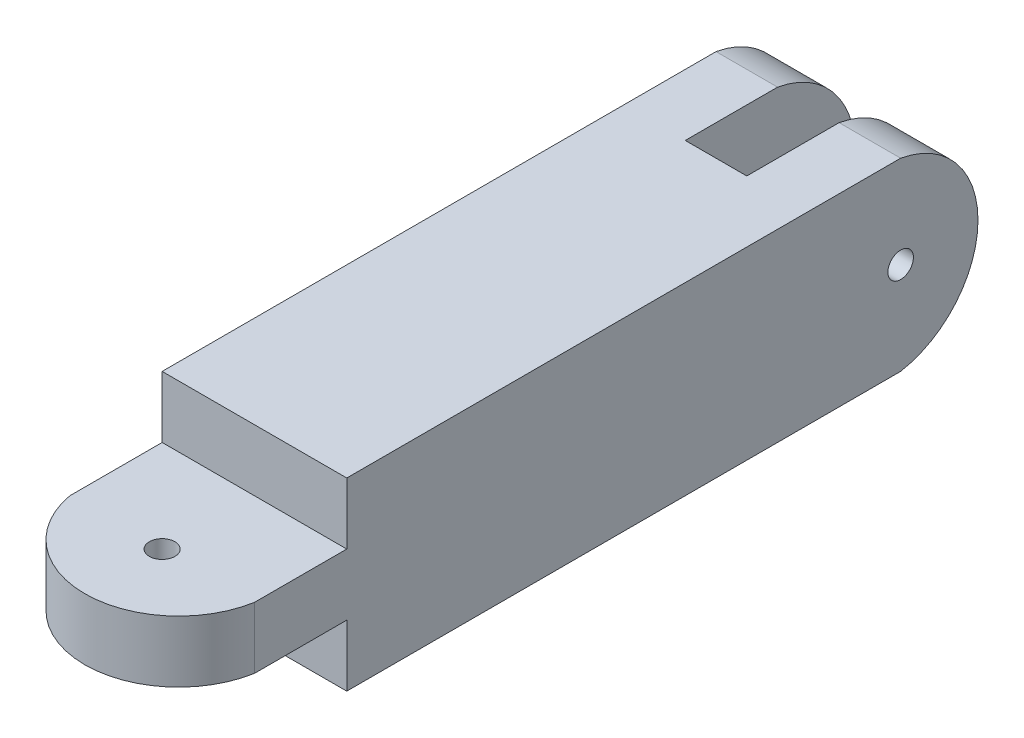
from build123d import *

# Parameters (mm, degrees)
SKETCH2_W               = 60
SKETCH2_H               = 60
BOSS_EXTRUDE1_DEPTH     = 150
SKETCH3_W               = 20
SKETCH3_H               = 60
BOSS_EXTRUDE2_DEPTH     = 30
BOSS_EXTRUDE3_DEPTH     = 20
BOSS_EXTRUDE4_START     = -20
BOSS_EXTRUDE4_DEPTH     = 20
SKETCH6_W               = 60
SKETCH6_H               = 20
BOSS_EXTRUDE5_DEPTH     = 30
BOSS_EXTRUDE6_DEPTH     = 20
CUT_EXTRUDE2_DEPTH      = 5
CUT_EXTRUDE2_DEPTH_BACK = 130
CUT_EXTRUDE2_START      = -10
SKETCH8_W               = 50.5
SKETCH8_H               = 50.5
SKETCH9_R               = 4.15
CUT_EXTRUDE3_DEPTH      = 130
SKETCH11_R              = 4.15
CUT_EXTRUDE4_DEPTH      = 212.144400343
SKETCH12_R              = 4.15
CUT_EXTRUDE5_DEPTH      = 212.144400343


with BuildPart() as part:
    # Sketch2 → Boss-Extrude1 (new body)
    with BuildSketch(Plane.XY):
        Rectangle(SKETCH2_W, SKETCH2_H)
    extrude(amount=BOSS_EXTRUDE1_DEPTH)

    # Sketch3 → Boss-Extrude2 (add)
    with BuildSketch(Plane(origin=(0, 0, 0), x_dir=(-1, 0, 0), z_dir=(0, 0, -1))):
        with Locations((20, 0)):
            Rectangle(SKETCH3_W, SKETCH3_H)
        with Locations((-20, 0)):
            Rectangle(SKETCH3_W, SKETCH3_H)
    extrude(amount=BOSS_EXTRUDE2_DEPTH)

    # Sketch4 → Boss-Extrude3 (add)
    with BuildSketch(Plane(origin=(30, 0, 0), x_dir=(0, 0, -1), z_dir=(1, 0, 0))):
        with BuildLine():
            Line((30, 30), (30, -30))
            ThreePointArc((30, -30), (55.138874415, 0), (30, 30))
        make_face()
    extrude(amount=-BOSS_EXTRUDE3_DEPTH)

    # Sketch5 → Boss-Extrude4 (add)
    with BuildSketch(Plane.ZY.offset(30).offset(BOSS_EXTRUDE4_START)):
        with BuildLine():
            Line((-30, -30), (-30, 30))
            ThreePointArc((-30, 30), (-55.138874415, 0), (-30, -30))
        make_face()
    extrude(amount=BOSS_EXTRUDE4_DEPTH)

    # Sketch6 → Boss-Extrude5 (add)
    with BuildSketch(Plane.XY.offset(150)):
        Rectangle(SKETCH6_W, SKETCH6_H)
    extrude(amount=BOSS_EXTRUDE5_DEPTH)

    # Sketch7 → Boss-Extrude6 (add)
    with BuildSketch(Plane(origin=(0, 10, 0), x_dir=(1, 0, 0), z_dir=(0, 1, 0))):
        with BuildLine():
            Line((30, -180), (-30, -180))
            ThreePointArc((-30, -180), (0, -205.138874415), (30, -180))
        make_face()
    extrude(amount=-BOSS_EXTRUDE6_DEPTH)

    # Sketch8 → Cut-Extrude2 (cut, two sides: drawn at the far end of the back side and taken through both)
    with BuildSketch(Plane.XY.offset(150).offset(CUT_EXTRUDE2_START - CUT_EXTRUDE2_DEPTH_BACK)):
        Rectangle(SKETCH8_W, SKETCH8_H)
    extrude(amount=CUT_EXTRUDE2_DEPTH + CUT_EXTRUDE2_DEPTH_BACK, mode=Mode.SUBTRACT)

    # Sketch9 → Cut-Extrude3 (cut)
    with BuildSketch(Plane(origin=(0, -10, 0), x_dir=(-1, 0, 0), z_dir=(0, -1, 0))):
        with Locations(Location((0, -180, 0), (0, 0, 90))):
            Circle(SKETCH9_R)
    extrude(amount=-CUT_EXTRUDE3_DEPTH, mode=Mode.SUBTRACT)

    # Sketch11 → Cut-Extrude4 (cut, through all)
    with BuildSketch(Plane.ZY.offset(-10)):
        with Locations(Location((-30, 0, 0), (0, 0, 270))):
            Circle(SKETCH11_R)
    extrude(amount=-CUT_EXTRUDE4_DEPTH, mode=Mode.SUBTRACT)

    # Sketch12 → Cut-Extrude5 (cut, through all)
    with BuildSketch(Plane(origin=(-10, 0, 0), x_dir=(0, 0, -1), z_dir=(1, 0, 0))):
        with Locations(Location((30, 0, 0), (0, 0, 270))):
            Circle(SKETCH12_R)
    extrude(amount=-CUT_EXTRUDE5_DEPTH, mode=Mode.SUBTRACT)


solid = part.part
